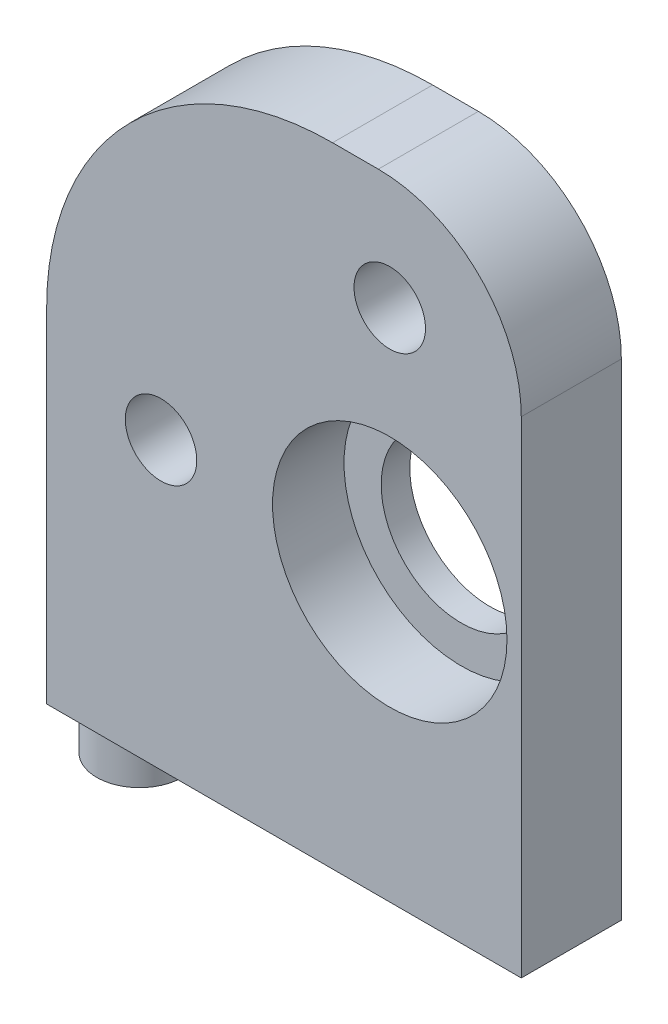
from build123d import *

# Parameters (mm, degrees)
SKETCH_1_W          = 16.6
SKETCH_1_H          = 22
SKETCH_1_R          = 1.25
SKETCH_1_R_2        = 4.1
EXTRUDE_1_DEPTH     = 3.5
SKETCH_1_3_R        = 4.1
SKETCH_1_3_R_2      = 2.8
EXTRUDE_2_DEPTH     = 1
FILLET_1_R          = 10
FILLET_2_R          = 5
SKETCH_2_R          = 1
CUT_EXTRUDE_1_DEPTH = 6
SKETCH_2_3_R        = 1.5
EXTRUDE_3_DEPTH     = 1.6


with BuildPart() as part:
    # 草图1 → 凸台-拉伸1 (new body)
    with BuildSketch(Plane.XY):
        with Locations((-3.7, 1)):
            Rectangle(SKETCH_1_W, SKETCH_1_H)
        with Locations((-8, 0)):
            Circle(SKETCH_1_R, mode=Mode.SUBTRACT)
        Circle(SKETCH_1_R_2, mode=Mode.SUBTRACT)
        with Locations((0, 8)):
            Circle(SKETCH_1_R, mode=Mode.SUBTRACT)
    extrude(amount=EXTRUDE_1_DEPTH)

    # 草图1<3> → 凸台-拉伸2 (add)
    with BuildSketch(Plane.XY):
        Circle(SKETCH_1_3_R)
        Circle(SKETCH_1_3_R_2, mode=Mode.SUBTRACT)
    extrude(amount=EXTRUDE_2_DEPTH)

    # 圆角1
    fillet_1_edges = [part.edges().sort_by_distance(p)[0] for p in [
        (-12, 12, 1.75),
    ]]
    fillet(fillet_1_edges, radius=FILLET_1_R)

    # 圆角2
    fillet_2_edges = [part.edges().sort_by_distance(p)[0] for p in [
        (4.6, 12, 1.75),
    ]]
    fillet(fillet_2_edges, radius=FILLET_2_R)

    # 草图2 → 切除-拉伸1 (cut)
    with BuildSketch(Plane.XZ.offset(10)):
        with Locations((-4.5, 1.75)):
            Circle(SKETCH_2_R)
    extrude(amount=-CUT_EXTRUDE_1_DEPTH, mode=Mode.SUBTRACT)

    # 草图2<3> → 凸台-拉伸3 (add)
    with BuildSketch(Plane.XZ.offset(10)):
        with Locations((-10.5, 1.75)):
            Circle(SKETCH_2_3_R)
    extrude(amount=EXTRUDE_3_DEPTH)


solid = part.part
